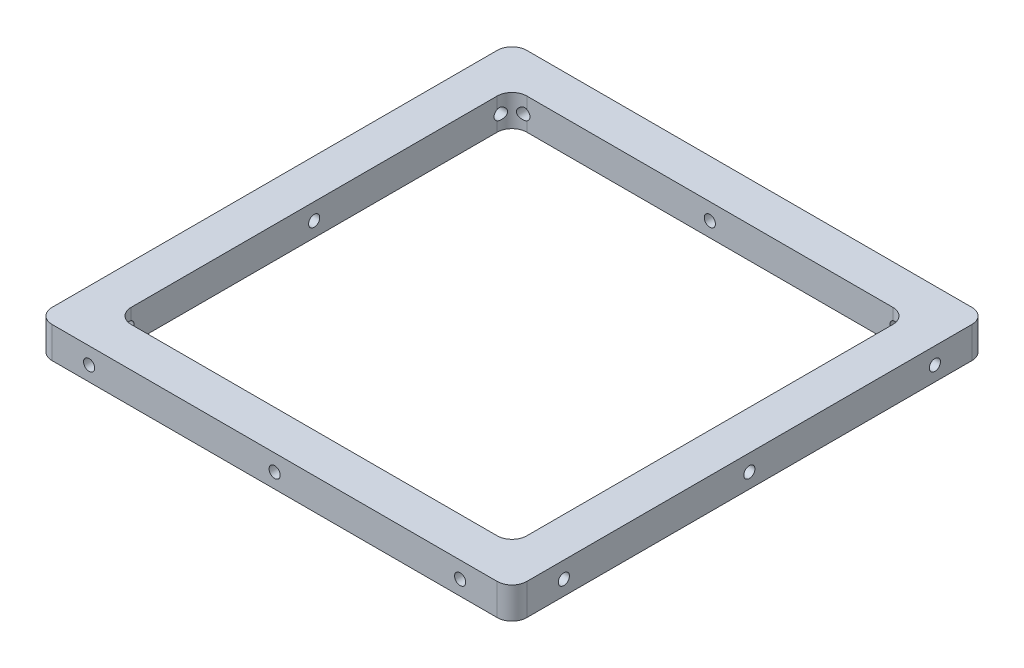
from build123d import *

# Parameters (mm, degrees)
SKETCH1_W                   = 96.1
SKETCH1_H                   = 96.1
SKETCH1_W_2                 = 80.1
SKETCH1_H_2                 = 80.1
BOSS_EXTRUDE1_DEPTH         = 6.35
FILLET1_R                   = 3
F_43_0_089_DIAMETER_HOLE1_D = 2.2606
F_43_0_089_DIAMETER_HOLE2_D = 2.2606


with BuildPart() as part:
    # Sketch1 → Boss-Extrude1 (new body)
    with BuildSketch(Plane(origin=(0, 0, 0), x_dir=(1, 0, 0), z_dir=(0, 1, 0))):
        Rectangle(SKETCH1_W, SKETCH1_H)
        Rectangle(SKETCH1_W_2, SKETCH1_H_2, mode=Mode.SUBTRACT)
    extrude(amount=BOSS_EXTRUDE1_DEPTH)

    # Fillet1
    fillet1_edges = [part.edges().sort_by_distance(p)[0] for p in [
        (-40.05, 3.175, 40.05),
        (40.05, 3.175, 40.05),
        (40.05, 3.175, -40.05),
        (-40.05, 3.175, -40.05),
        (-48.05, 3.175, -48.05),
        (48.05, 3.175, -48.05),
        (48.05, 3.175, 48.05),
        (-48.05, 3.175, 48.05),
    ]]
    fillet(fillet1_edges, radius=FILLET1_R)

    # #43 (0.089) Diameter Hole1 (through all)
    with Locations(Plane(origin=(0, 0, -48.05), x_dir=(-1, 0, 0), z_dir=(0, 0, -1))):
        with Locations((0, 3), (-37.55, 3), (37.55, 3)):
            Hole(F_43_0_089_DIAMETER_HOLE1_D / 2)

    # #43 (0.089) Diameter Hole2 (through all)
    with Locations(Plane.ZY.offset(48.05)):
        with Locations((0, 3), (-37.55, 3), (37.55, 3)):
            Hole(F_43_0_089_DIAMETER_HOLE2_D / 2)


solid = part.part
